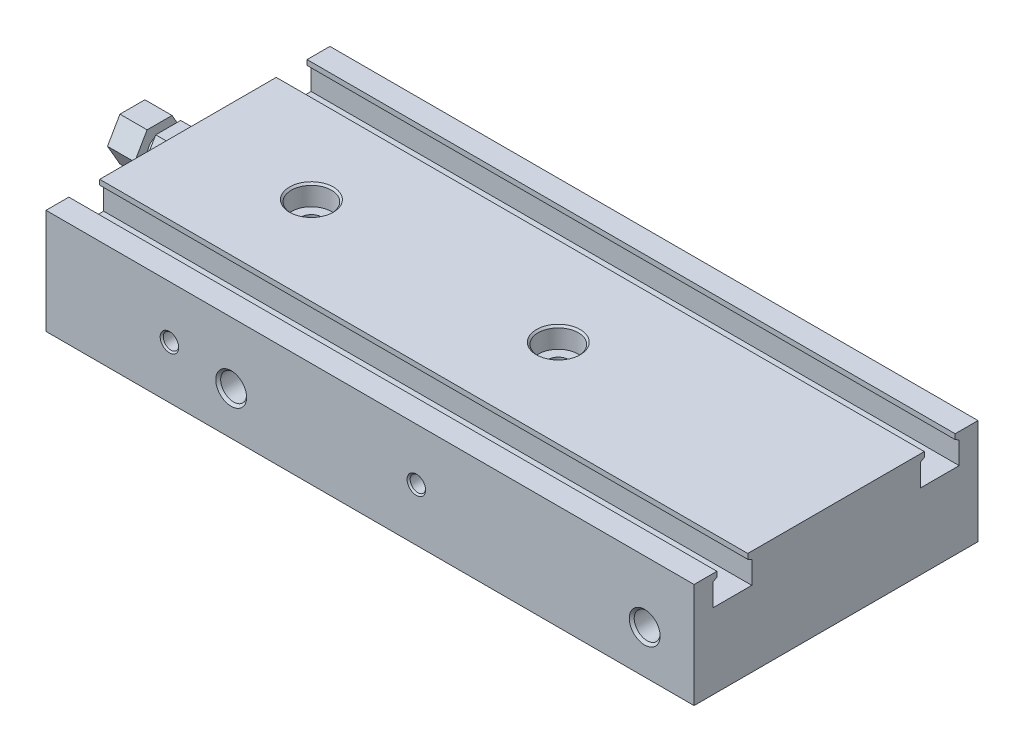
from build123d import *

# Parameters (mm, degrees)
BODY_SKETCH_W                                = 46
BODY_SKETCH_H                                = 17
BODY_DEPTH                                   = 105
BODY_ROD_HOLES_SKETCH_R                      = 3
BODY_ROD_HOLES_DEPTH                         = 10
BODY_PISTON_HOLES_SKETCH_R                   = 4.05
BODY_PISTON_HOLES_DEPTH                      = 51
TOP_SWITCH_GROOVES_DEPTH                     = 108.953693777
SHCS_MGT_HOLE_CHAM_SIZE                      = 0.3
SHCS_MGT_HOLE_PAT_COUNT                      = 2
SHCS_MGT_HOLE_PAT_PITCH                      = 40
SHCS_MGT_HOLE_CHAM_OF_SHCS_MGT_HOLE_PAT_SIZE = 0.3
SHCS_MGT_HOLE_BOT_TAP_AT_2_COUNT             = 2
SHCS_MGT_HOLE_BOT_TAP_AT_2_PITCH             = 40
ADJUSTER_NUT_DEPTH                           = 9
ADJUSTER_NUT_THREADS_SKETCH_W                = 1.4
ADJUSTER_NUT_THREADS_SKETCH_H                = 17
TAP_DRILL_FOR_M5X0_8_TAP1_D                  = 4.2
TAP_DRILL_FOR_M5X0_8_TAP1_DEPTH              = 4.5
TAP_DRILL_FOR_M5X0_8_TAP1_CSINK_D            = 5
TAP_DRILL_FOR_M5X0_8_TAP1_CSINK_ANGLE        = 90
TAP_DRILL_FOR_M5X0_8_TAP1_TIP                = 1.2618073
TAP_DRILL_FOR_M5X0_8_TAP2_D                  = 4.2
TAP_DRILL_FOR_M5X0_8_TAP2_DEPTH              = 4.5
TAP_DRILL_FOR_M5X0_8_TAP2_CSINK_D            = 5
TAP_DRILL_FOR_M5X0_8_TAP2_CSINK_ANGLE        = 90
TAP_DRILL_FOR_M5X0_8_TAP2_TIP                = 1.2618073
MOUNT_HOLES_1_D                              = 2.5
MOUNT_HOLES_1_DEPTH                          = 4.5
MOUNT_HOLES_1_CSINK_D                        = 3
MOUNT_HOLES_1_CSINK_ANGLE                    = 90
MOUNT_HOLES_1_TIP                            = 0.751075774
MOUNT_HOLES_2_D                              = 2.5
MOUNT_HOLES_2_DEPTH                          = 4.5
MOUNT_HOLES_2_CSINK_D                        = 3
MOUNT_HOLES_2_CSINK_ANGLE                    = 90
MOUNT_HOLES_2_TIP                            = 0.751075774


with BuildPart() as part:
    # Body_Sketch → Body (new body)
    with BuildSketch(Plane(origin=(0, 0, 0), x_dir=(0, 0, -1), z_dir=(1, 0, 0))):
        with Locations((0, 1.5)):
            Rectangle(BODY_SKETCH_W, BODY_SKETCH_H)
    extrude(amount=BODY_DEPTH)

    # Body Rod Holes_Sketch → Body Rod Holes (cut)
    with BuildSketch(Plane.ZY):
        with Locations((-10, 0)):
            Circle(BODY_ROD_HOLES_SKETCH_R)
        with Locations(Location((10, 0, 0), (0, 0, 180))):
            Circle(BODY_ROD_HOLES_SKETCH_R)
    extrude(amount=-BODY_ROD_HOLES_DEPTH, mode=Mode.SUBTRACT)

    # Body Piston Holes_Sketch → Body Piston Holes (cut)
    with BuildSketch(Plane.ZY.offset(-10)):
        with Locations((10, 0)):
            Circle(BODY_PISTON_HOLES_SKETCH_R)
        with Locations((-10, 0)):
            Circle(BODY_PISTON_HOLES_SKETCH_R)
    extrude(amount=-BODY_PISTON_HOLES_DEPTH, mode=Mode.SUBTRACT)

    # Top Switch Grooves_Sketch → Top Switch Grooves (cut, through all)
    with BuildSketch(Plane.ZY):
        Polygon((13.65, 5.2), (19.95, 5.2), (19.95, 8.8), (19.3, 9.175277675), (19.3, 10), (14.3, 10), (14.3, 9.175277675), (13.65, 8.8), align=None)
        Polygon((-13.65, 8.8), (-13.65, 5.2), (-19.95, 5.2), (-19.95, 8.8), (-19.3, 9.175277675), (-19.3, 10), (-14.3, 10), (-14.3, 9.175277675), align=None)
    extrude(amount=-TOP_SWITCH_GROOVES_DEPTH, mode=Mode.SUBTRACT)

    # SHCS MGT Hole_Sketch → SHCS MGT Hole (revolve, cut)
    with BuildSketch(Plane.XY, mode=Mode.PRIVATE) as shcs_mgt_hole_sk:
        Polygon((20, 10), (16.75, 10), (16.75, 6.7), (18.3, 6.7), (18.3, -7), (20, -7), align=None)
    shcs_mgt_hole = revolve(shcs_mgt_hole_sk.sketch.rotate(Axis((20, -11.506886035, 0), (0, 1, 0)), 270), axis=Axis((20, -11.506886035, 0), (0, 1, 0)), mode=Mode.SUBTRACT)

    # SHCS MGT Hole Cham
    shcs_mgt_hole_cham_edges = [part.edges().sort_by_distance(p)[0] for p in [
        (20, 10, 3.25),
    ]]
    chamfer(shcs_mgt_hole_cham_edges, length=SHCS_MGT_HOLE_CHAM_SIZE)

    # SHCS MGT Hole Pat: SHCS MGT Hole ×2
    with Locations(*[(i * SHCS_MGT_HOLE_PAT_PITCH, 0, 0) for i in range(1, SHCS_MGT_HOLE_PAT_COUNT)]):
        add(shcs_mgt_hole, mode=Mode.SUBTRACT)

    # SHCS MGT Hole Cham of SHCS MGT Hole Pat
    shcs_mgt_hole_cham_of_shcs_mgt_hole_pat_edges = [part.edges().sort_by_distance(p)[0] for p in [
        (60, 10, 3.25),
    ]]
    chamfer(shcs_mgt_hole_cham_of_shcs_mgt_hole_pat_edges, length=SHCS_MGT_HOLE_CHAM_OF_SHCS_MGT_HOLE_PAT_SIZE)

    # SHCS MGT Hole Bot Tap Profile → SHCS MGT Hole Bot Tap (revolve, cut)
    with BuildSketch(Plane(origin=(20, -7, 0), x_dir=(0, 0, -1), z_dir=(1, 0, 0))):
        Polygon((0, 0), (0, 9.021463052), (1.7, 8), (1.7, 7), (2, 7), (2, 0.3), (2.3, 0), align=None)
    shcs_mgt_hole_bot_tap = revolve(axis=Axis((20, -13.35, 0), (0, 1, 0)), mode=Mode.SUBTRACT)

    # SHCS MGT Hole Bot Tap at 2: SHCS MGT Hole Bot Tap ×2
    with Locations(*[(i * SHCS_MGT_HOLE_BOT_TAP_AT_2_PITCH, 0, 0) for i in range(1, SHCS_MGT_HOLE_BOT_TAP_AT_2_COUNT)]):
        add(shcs_mgt_hole_bot_tap, mode=Mode.SUBTRACT)

    # Adjuster Nut_Sketch → Adjuster Nut (add)
    with BuildSketch(Plane.ZY):
        Polygon((-2.020725942, 8.5), (2.020725942, 8.5), (4.041451884, 5), (2.020725942, 1.5), (-2.020725942, 1.5), (-4.041451884, 5), align=None)
    extrude(amount=ADJUSTER_NUT_DEPTH)

    # Adjuster Nut Threads_Sketch → Adjuster Nut Threads (revolve, cut)
    with BuildSketch(Plane.XY, mode=Mode.PRIVATE) as adjuster_nut_threads_sk:
        with Locations((-3.9, 15.5)):
            Rectangle(ADJUSTER_NUT_THREADS_SKETCH_W, ADJUSTER_NUT_THREADS_SKETCH_H)
    revolve(adjuster_nut_threads_sk.sketch.rotate(Axis((-6.476, 5, 0), (1, 0, 0)), 270), axis=Axis((-6.476, 5, 0), (1, 0, 0)), mode=Mode.SUBTRACT)

    # Tap Drill for M5x0.8 Tap1
    with Locations(Plane.XY.offset(23)):
        with Locations((30, 0), (97, 0)):
            CounterSinkHole(TAP_DRILL_FOR_M5X0_8_TAP1_D / 2, TAP_DRILL_FOR_M5X0_8_TAP1_CSINK_D / 2, depth=TAP_DRILL_FOR_M5X0_8_TAP1_DEPTH, counter_sink_angle=TAP_DRILL_FOR_M5X0_8_TAP1_CSINK_ANGLE)
            with Locations((0, 0, -(TAP_DRILL_FOR_M5X0_8_TAP1_DEPTH + TAP_DRILL_FOR_M5X0_8_TAP1_TIP / 2))):  # 118° drill point
                Cone(0, TAP_DRILL_FOR_M5X0_8_TAP1_D / 2, TAP_DRILL_FOR_M5X0_8_TAP1_TIP, mode=Mode.SUBTRACT)

    # Tap Drill for M5x0.8 Tap2
    with Locations(Plane(origin=(0, 0, -23), x_dir=(-1, 0, 0), z_dir=(0, 0, -1))):
        with Locations((-97, 0), (-30, 0)):
            CounterSinkHole(TAP_DRILL_FOR_M5X0_8_TAP2_D / 2, TAP_DRILL_FOR_M5X0_8_TAP2_CSINK_D / 2, depth=TAP_DRILL_FOR_M5X0_8_TAP2_DEPTH, counter_sink_angle=TAP_DRILL_FOR_M5X0_8_TAP2_CSINK_ANGLE)
            with Locations((0, 0, -(TAP_DRILL_FOR_M5X0_8_TAP2_DEPTH + TAP_DRILL_FOR_M5X0_8_TAP2_TIP / 2))):  # 118° drill point
                Cone(0, TAP_DRILL_FOR_M5X0_8_TAP2_D / 2, TAP_DRILL_FOR_M5X0_8_TAP2_TIP, mode=Mode.SUBTRACT)

    # Mount_Holes_1
    with Locations(Plane.XY.offset(23)):
        with Locations((20, 1.5), (60, 1.5)):
            CounterSinkHole(MOUNT_HOLES_1_D / 2, MOUNT_HOLES_1_CSINK_D / 2, depth=MOUNT_HOLES_1_DEPTH, counter_sink_angle=MOUNT_HOLES_1_CSINK_ANGLE)
            with Locations((0, 0, -(MOUNT_HOLES_1_DEPTH + MOUNT_HOLES_1_TIP / 2))):  # 118° drill point
                Cone(0, MOUNT_HOLES_1_D / 2, MOUNT_HOLES_1_TIP, mode=Mode.SUBTRACT)

    # Mount_Holes_2
    with Locations(Plane(origin=(0, 0, -23), x_dir=(-1, 0, 0), z_dir=(0, 0, -1))):
        with Locations((-60, 1.5), (-20, 1.5)):
            CounterSinkHole(MOUNT_HOLES_2_D / 2, MOUNT_HOLES_2_CSINK_D / 2, depth=MOUNT_HOLES_2_DEPTH, counter_sink_angle=MOUNT_HOLES_2_CSINK_ANGLE)
            with Locations((0, 0, -(MOUNT_HOLES_2_DEPTH + MOUNT_HOLES_2_TIP / 2))):  # 118° drill point
                Cone(0, MOUNT_HOLES_2_D / 2, MOUNT_HOLES_2_TIP, mode=Mode.SUBTRACT)


solid = part.part
